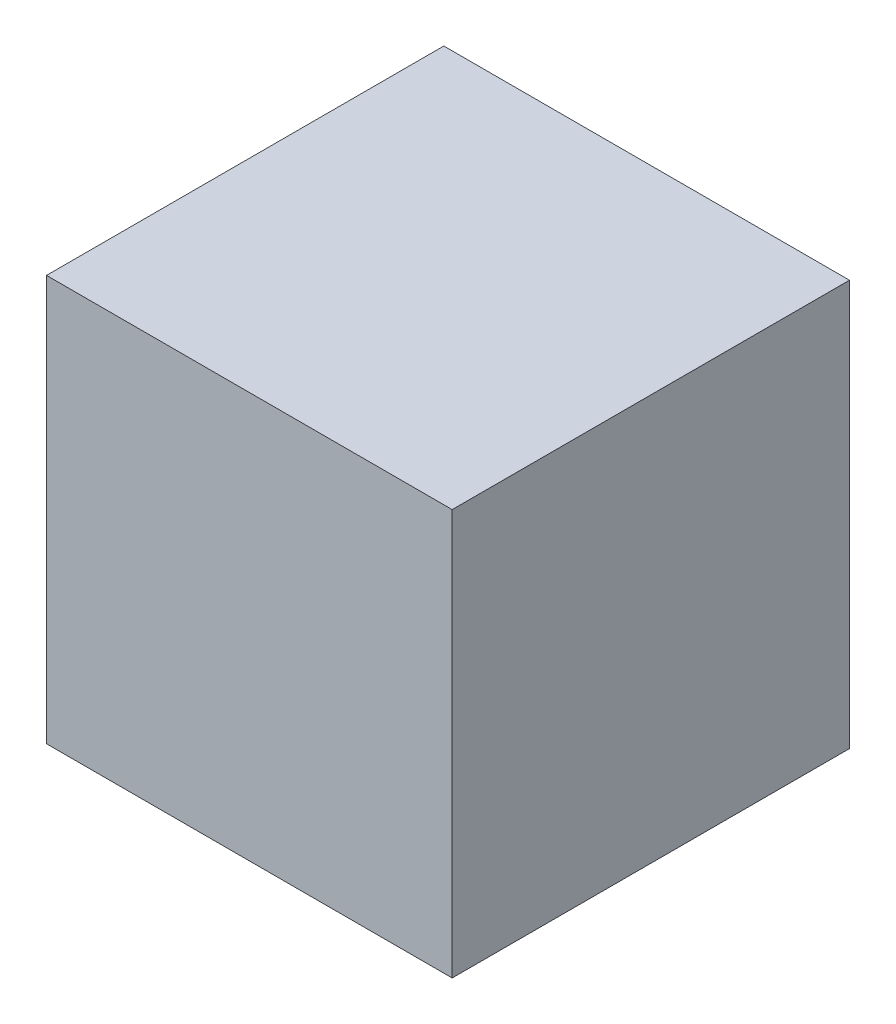
from build123d import *

# Parameters (mm, degrees)
SKETCH1_W           = 97
SKETCH1_H           = 95
BOSS_EXTRUDE1_DEPTH = 48.5


with BuildPart() as part:
    # Sketch1 → Boss-Extrude1 (new, symmetric)
    with BuildSketch(Plane(origin=(0, 0, 0), x_dir=(1, 0, 0), z_dir=(0, 1, 0))):
        Rectangle(SKETCH1_W, SKETCH1_H)
    extrude(amount=BOSS_EXTRUDE1_DEPTH, both=True)


solid = part.part
